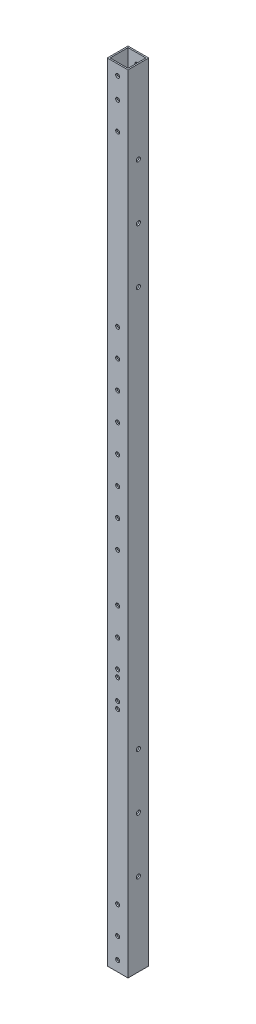
from build123d import *

# Parameters (mm, degrees)
SKETCH_1_W               = 15
SKETCH_1_H               = 15
SKETCH_1_W_2             = 13
SKETCH_1_H_2             = 13
EXTRUDE_1_DEPTH          = 570
CUT_EXTRUDE_1_DEPTH      = 10
CUT_EXTRUDE_1_DEPTH_BACK = 571.098675669
SKETCH_2_R               = 1.45
SKETCH_3_R               = 1.5
CUT_EXTRUDE_2_DEPTH      = 571.246657158


with BuildPart() as part:
    # 草图1 → 拉伸-薄壁1 (new body)
    with BuildSketch(Plane(origin=(0, 0, 0), x_dir=(1, 0, 0), z_dir=(0, 1, 0))):
        Rectangle(SKETCH_1_W, SKETCH_1_H)
        Rectangle(SKETCH_1_W_2, SKETCH_1_H_2, mode=Mode.SUBTRACT)
    extrude(amount=EXTRUDE_1_DEPTH)

    # 草图2 → 切除-拉伸1 (cut, two sides: drawn at the far end of the back side and taken through both)
    with BuildSketch(Plane.XY.offset(-CUT_EXTRUDE_1_DEPTH_BACK)):
        with Locations(Location((0, 7.5, 0), (0, 0, 180))):
            Circle(SKETCH_2_R)
        with Locations(Location((0, 22.5, 0), (0, 0, 180))):
            Circle(SKETCH_2_R)
        with Locations(Location((0, 42.5, 0), (0, 0, 180))):
            Circle(SKETCH_2_R)
        with Locations(Location((0, 527.5, 0), (0, 0, 180))):
            Circle(SKETCH_2_R)
        with Locations(Location((0, 547.5, 0), (0, 0, 180))):
            Circle(SKETCH_2_R)
        with Locations(Location((0, 562.5, 0), (0, 0, 180))):
            Circle(SKETCH_2_R)
        with Locations(Location((0, 285, 0), (0, 0, 180))):
            Circle(SKETCH_2_R)
        with Locations(Location((0, 305, 0), (0, 0, 180))):
            Circle(SKETCH_2_R)
        with Locations(Location((0, 265, 0), (0, 0, 180))):
            Circle(SKETCH_2_R)
        with Locations(Location((0, 190, 0), (0, 0, 180))):
            Circle(SKETCH_2_R)
        with Locations(Location((0, 170, 0), (0, 0, 180))):
            Circle(SKETCH_2_R)
        with Locations(Location((0, 230, 0), (0, 0, 180))):
            Circle(SKETCH_2_R)
        with Locations(Location((0, 210, 0), (0, 0, 180))):
            Circle(SKETCH_2_R)
        with Locations(Location((0, 405, 0), (0, 0, 180))):
            Circle(SKETCH_2_R)
        with Locations(Location((0, 385, 0), (0, 0, 180))):
            Circle(SKETCH_2_R)
        with Locations(Location((0, 185, 0), (0, 0, 180))):
            Circle(SKETCH_2_R)
        with Locations(Location((0, 165, 0), (0, 0, 180))):
            Circle(SKETCH_2_R)
        with Locations(Location((0, 325, 0), (0, 0, 180))):
            Circle(SKETCH_2_R)
        with Locations(Location((0, 345, 0), (0, 0, 180))):
            Circle(SKETCH_2_R)
        with Locations(Location((0, 365, 0), (0, 0, 180))):
            Circle(SKETCH_2_R)
    extrude(amount=CUT_EXTRUDE_1_DEPTH + CUT_EXTRUDE_1_DEPTH_BACK, mode=Mode.SUBTRACT)

    # 草图3 → 切除-拉伸2 (cut, through all)
    with BuildSketch(Plane(origin=(7.5, 0, 0), x_dir=(0, 0, -1), z_dir=(1, 0, 0))):
        with Locations((0, 60)):
            Circle(SKETCH_3_R)
        with Locations((0, 100)):
            Circle(SKETCH_3_R)
        with Locations((0, 470)):
            Circle(SKETCH_3_R)
        with Locations((0, 510)):
            Circle(SKETCH_3_R)
        with Locations((0, 140)):
            Circle(SKETCH_3_R)
        with Locations((0, 430)):
            Circle(SKETCH_3_R)
    extrude(amount=-CUT_EXTRUDE_2_DEPTH, mode=Mode.SUBTRACT)


solid = part.part
